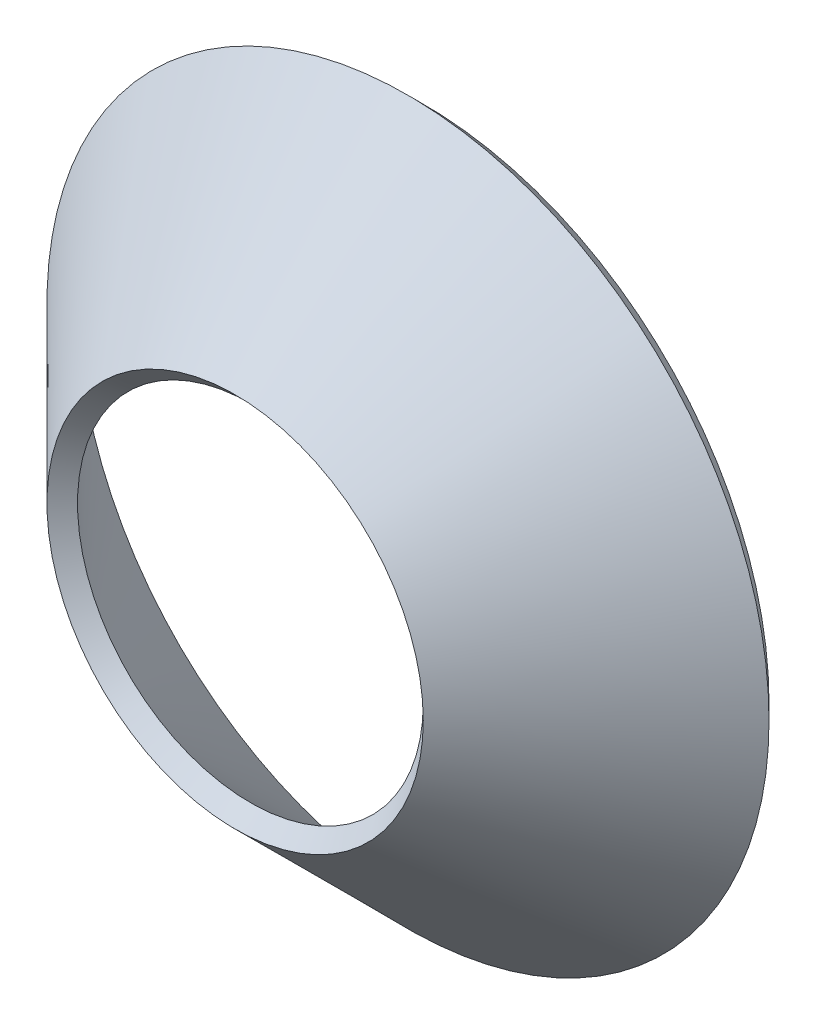
from build123d import *


with BuildPart() as part:
    # Sketch1 → Revolve-Thin1 (revolve)
    with BuildSketch(Plane.YZ, mode=Mode.PRIVATE) as revolve_thin1_sk:
        Polygon((25.4, 25.4), (50.8, 0), (53.04506403, 2.24506403), (27.64506403, 27.64506403), align=None)
    revolve(revolve_thin1_sk.sketch.rotate(Axis((0, 0, 26.67), (0, 0, -1)), 90), axis=Axis((0, 0, 26.67), (0, 0, -1)))


solid = part.part
